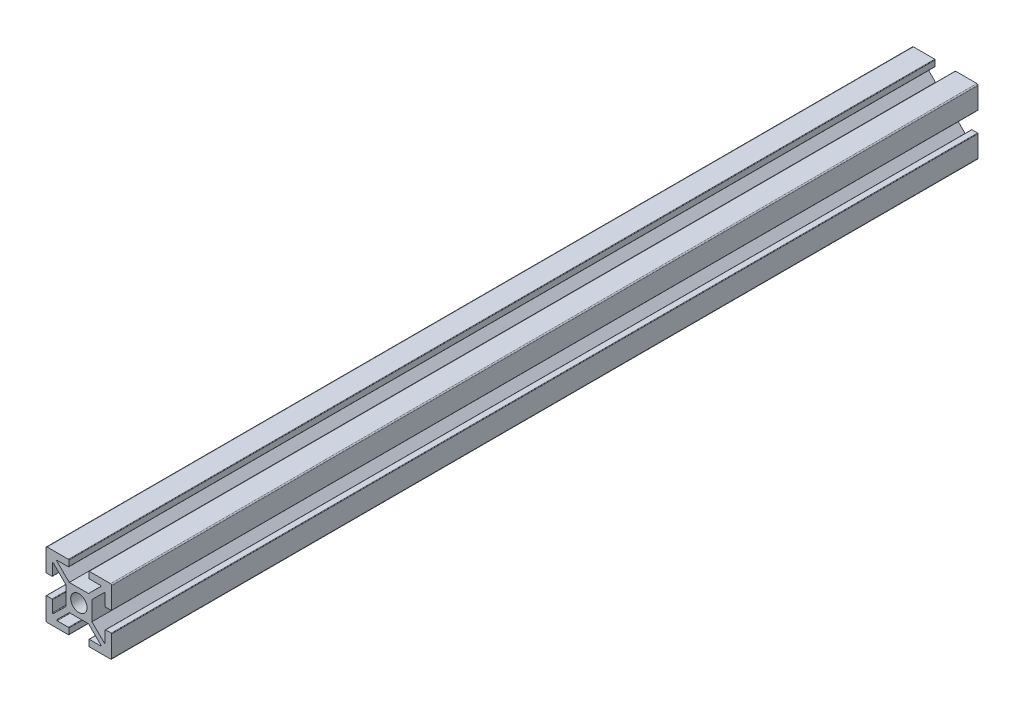
from build123d import *

# Parameters (mm, degrees)
SKETCH1_R           = 2.5
BOSS_EXTRUDE1_DEPTH = 264.91


with BuildPart() as part:
    # Sketch1 → Boss-Extrude1 (new body)
    with BuildSketch(Plane.XY):
        with BuildLine():
            Line((-31.376404226, -0.06181021), (-29.676404226, -0.06181021))
            ThreePointArc((-29.676404226, -0.06181021), (-29.570338208, -0.017876227), (-29.526404226, 0.08818979))
            Line((-29.526404226, 0.08818979), (-29.526404226, 3.524374304))
            ThreePointArc((-29.526404226, 3.524374304), (-29.43420518, 3.662790523), (-29.27095023, 3.631048831))
            Line((-29.27095023, 3.631048831), (-25.480107929, -0.116419988))
            Line((-25.480107929, -0.116419988), (-25.480107929, -6.007200432))
            Line((-25.480107929, -6.007200432), (-29.27095023, -9.754669251))
            ThreePointArc((-29.27095023, -9.754669251), (-29.43420518, -9.786410942), (-29.526404226, -9.647994723))
            Line((-29.526404226, -9.647994723), (-29.526404226, -6.21181021))
            ThreePointArc((-29.526404226, -6.21181021), (-29.570338208, -6.105744193), (-29.676404226, -6.06181021))
            Line((-29.676404226, -6.06181021), (-31.376404226, -6.06181021))
            ThreePointArc((-31.376404226, -6.06181021), (-31.482470243, -6.105744193), (-31.526404226, -6.21181021))
            Line((-31.526404226, -6.21181021), (-31.526404226, -12.71181021))
            ThreePointArc((-31.526404226, -12.71181021), (-31.423891599, -12.959297583), (-31.176404226, -13.06181021))
            Line((-31.176404226, -13.06181021), (-24.676404226, -13.06181021))
            ThreePointArc((-24.676404226, -13.06181021), (-24.570338208, -13.017876227), (-24.526404226, -12.91181021))
            Line((-24.526404226, -12.91181021), (-24.526404226, -11.21181021))
            ThreePointArc((-24.526404226, -11.21181021), (-24.570338208, -11.105744193), (-24.676404226, -11.06181021))
            Line((-24.676404226, -11.06181021), (-28.094489023, -11.06181021))
            ThreePointArc((-28.094489023, -11.06181021), (-28.233235517, -10.96881381), (-28.199943018, -10.805135682))
            Line((-28.199943018, -10.805135682), (-24.41329202, -7.06181021))
            Line((-24.41329202, -7.06181021), (-18.546923839, -7.06181021))
            Line((-18.546923839, -7.06181021), (-14.760272841, -10.805135682))
            ThreePointArc((-14.760272841, -10.805135682), (-14.726980342, -10.96881381), (-14.865726836, -11.06181021))
            Line((-14.865726836, -11.06181021), (-18.283811633, -11.06181021))
            ThreePointArc((-18.283811633, -11.06181021), (-18.38987765, -11.105744193), (-18.433811633, -11.21181021))
            Line((-18.433811633, -11.21181021), (-18.433811633, -12.91181021))
            ThreePointArc((-18.433811633, -12.91181021), (-18.38987765, -13.017876227), (-18.283811633, -13.06181021))
            Line((-18.283811633, -13.06181021), (-11.783811633, -13.06181021))
            ThreePointArc((-11.783811633, -13.06181021), (-11.53632426, -12.959297583), (-11.433811633, -12.71181021))
            Line((-11.433811633, -12.71181021), (-11.433811633, -6.21181021))
            ThreePointArc((-11.433811633, -6.21181021), (-11.477745616, -6.105744193), (-11.583811633, -6.06181021))
            Line((-11.583811633, -6.06181021), (-13.283811633, -6.06181021))
            ThreePointArc((-13.283811633, -6.06181021), (-13.38987765, -6.105744193), (-13.433811633, -6.21181021))
            Line((-13.433811633, -6.21181021), (-13.433811633, -9.647994723))
            ThreePointArc((-13.433811633, -9.647994723), (-13.526010678, -9.786410942), (-13.689265628, -9.754669251))
            Line((-13.689265628, -9.754669251), (-17.480107929, -6.007200432))
            Line((-17.480107929, -6.007200432), (-17.480107929, -0.116419988))
            Line((-17.480107929, -0.116419988), (-13.689265628, 3.631048831))
            ThreePointArc((-13.689265628, 3.631048831), (-13.526010678, 3.662790523), (-13.433811633, 3.524374304))
            Line((-13.433811633, 3.524374304), (-13.433811633, 0.08818979))
            ThreePointArc((-13.433811633, 0.08818979), (-13.38987765, -0.017876227), (-13.283811633, -0.06181021))
            Line((-13.283811633, -0.06181021), (-11.583811633, -0.06181021))
            ThreePointArc((-11.583811633, -0.06181021), (-11.477745616, -0.017876227), (-11.433811633, 0.08818979))
            Line((-11.433811633, 0.08818979), (-11.433811633, 6.58818979))
            ThreePointArc((-11.433811633, 6.58818979), (-11.53632426, 6.835677164), (-11.783811633, 6.93818979))
            Line((-11.783811633, 6.93818979), (-18.283811633, 6.93818979))
            ThreePointArc((-18.283811633, 6.93818979), (-18.38987765, 6.894255807), (-18.433811633, 6.78818979))
            Line((-18.433811633, 6.78818979), (-18.433811633, 5.08818979))
            ThreePointArc((-18.433811633, 5.08818979), (-18.38987765, 4.982123773), (-18.283811633, 4.93818979))
            Line((-18.283811633, 4.93818979), (-14.865726836, 4.93818979))
            ThreePointArc((-14.865726836, 4.93818979), (-14.726980342, 4.84519339), (-14.760272841, 4.681515262))
            Line((-14.760272841, 4.681515262), (-18.546923839, 0.93818979))
            Line((-18.546923839, 0.93818979), (-24.41329202, 0.93818979))
            Line((-24.41329202, 0.93818979), (-28.199943018, 4.681515262))
            ThreePointArc((-28.199943018, 4.681515262), (-28.233235517, 4.84519339), (-28.094489023, 4.93818979))
            Line((-28.094489023, 4.93818979), (-24.676404226, 4.93818979))
            ThreePointArc((-24.676404226, 4.93818979), (-24.570338208, 4.982123773), (-24.526404226, 5.08818979))
            Line((-24.526404226, 5.08818979), (-24.526404226, 6.78818979))
            ThreePointArc((-24.526404226, 6.78818979), (-24.570338208, 6.894255807), (-24.676404226, 6.93818979))
            Line((-24.676404226, 6.93818979), (-31.176404226, 6.93818979))
            ThreePointArc((-31.176404226, 6.93818979), (-31.423891599, 6.835677164), (-31.526404226, 6.58818979))
            Line((-31.526404226, 6.58818979), (-31.526404226, 0.08818979))
            ThreePointArc((-31.526404226, 0.08818979), (-31.482470243, -0.017876227), (-31.376404226, -0.06181021))
        make_face()
        with Locations((-21.480107929, -3.06181021)):
            Circle(SKETCH1_R, mode=Mode.SUBTRACT)
    extrude(amount=BOSS_EXTRUDE1_DEPTH)


solid = part.part
